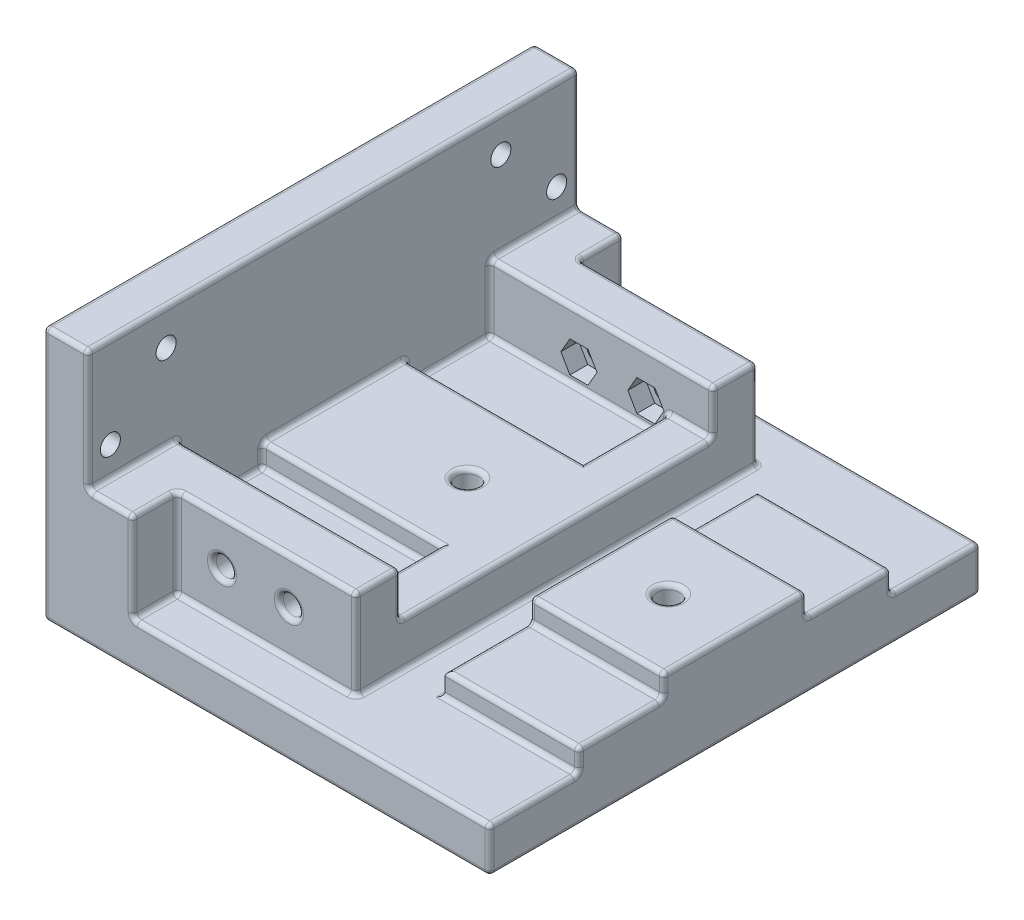
from build123d import *

# Parameters (mm, degrees)
SKETCH1_R                   = 2.25
BOSS_EXTRUDE1_DEPTH         = 10
BOSS_EXTRUDE2_DEPTH         = 50
SKETCH8_W                   = 10
SKETCH8_H                   = 20
BOSS_EXTRUDE3_DEPTH         = 10
SKETCH9_R                   = 2.25
CUT_EXTRUDE4_DEPTH          = 110
CUT_EXTRUDE6_DEPTH          = 4
CUT_EXTRUDE7_DEPTH          = 4
BOSS_EXTRUDE4_DEPTH         = 5
BOSS_EXTRUDE5_DEPTH         = 10
SKETCH17_W                  = 40
SKETCH17_H                  = 10
BOSS_EXTRUDE6_DEPTH         = 10
SKETCH18_W                  = 40
SKETCH18_H                  = 10
BOSS_EXTRUDE7_DEPTH         = 10
BOSS_EXTRUDE8_DEPTH         = 40
SKETCH21_W                  = 30
SKETCH21_H                  = 70
BOSS_EXTRUDE9_DEPTH         = 5
SKETCH22_W                  = 30
SKETCH22_H                  = 32
BOSS_EXTRUDE10_DEPTH        = 5
F_1_4_20_TAPPED_HOLE1_D     = 5.1054
F_1_4_20_TAPPED_HOLE1_DEPTH = 20
F_1_4_20_TAPPED_HOLE1_TIP   = 1.533816902
F_1_4_20_TAPPED_HOLE2_D     = 5.1054
F_1_4_20_TAPPED_HOLE2_DEPTH = 20
F_1_4_20_TAPPED_HOLE2_TIP   = 1.533816902
FILLET5_R                   = 1


with BuildPart() as part:
    # Sketch1 → Boss-Extrude1 (new body)
    with BuildSketch(Plane(origin=(0, 0, 0), x_dir=(0, 0, -1), z_dir=(1, 0, 0))):
        Polygon((-38.693472114, 11.344926417), (-13.193472114, 11.344926417), (45.806527886, 11.344926417), (71.306527886, 11.344926417), (71.306527886, -35.655073583), (-38.693472114, -35.655073583), align=None)
        with Locations((-33.693472114, -9.155073583)):
            Circle(SKETCH1_R, mode=Mode.SUBTRACT)
        with Locations((-21.193472114, 3.344926417)):
            Circle(SKETCH1_R, mode=Mode.SUBTRACT)
        with Locations((66.306527886, -9.155073583)):
            Circle(SKETCH1_R, mode=Mode.SUBTRACT)
        with Locations((53.806527886, 3.344926417)):
            Circle(SKETCH1_R, mode=Mode.SUBTRACT)
    extrude(amount=BOSS_EXTRUDE1_DEPTH)

    # Sketch2 → Boss-Extrude2 (add)
    with BuildSketch(Plane(origin=(10, 0, 0), x_dir=(0, 0, -1), z_dir=(1, 0, 0))):
        Polygon((-28.693472114, -35.655073583), (61.306527886, -35.655073583), (61.306527886, -15.655073583), (51.306527886, -15.655073583), (51.306527886, -30.655073583), (-18.693472114, -30.655073583), (-18.693472114, -15.655073583), (-28.693472114, -15.655073583), align=None)
    extrude(amount=BOSS_EXTRUDE2_DEPTH)

    # Sketch8 → Boss-Extrude3 (add)
    with BuildSketch(Plane(origin=(10, 0, 0), x_dir=(0, 0, -1), z_dir=(1, 0, 0))):
        with Locations((-33.693472114, -25.655073583)):
            Rectangle(SKETCH8_W, SKETCH8_H)
        with Locations((66.306527886, -25.655073583)):
            Rectangle(SKETCH8_W, SKETCH8_H)
    extrude(amount=BOSS_EXTRUDE3_DEPTH)

    # Sketch9 → Cut-Extrude4 (cut)
    with BuildSketch(Plane.XY.offset(28.693472114)):
        with Locations((30, -25.655073583)):
            Circle(SKETCH9_R)
        with Locations((45, -25.655073583)):
            Circle(SKETCH9_R)
    extrude(amount=-CUT_EXTRUDE4_DEPTH, mode=Mode.SUBTRACT)

    # Sketch11 → Cut-Extrude6 (cut)
    with BuildSketch(Plane.XY.offset(-51.306527886)):
        Polygon((49.041451884, -25.655073583), (47.020725942, -22.155073583), (42.979274058, -22.155073583), (40.958548116, -25.655073583), (42.979274058, -29.155073583), (47.020725942, -29.155073583), align=None)
        Polygon((34.041451884, -25.655073583), (32.020725942, -22.155073583), (27.979274058, -22.155073583), (25.958548116, -25.655073583), (27.979274058, -29.155073583), (32.020725942, -29.155073583), align=None)
    extrude(amount=-CUT_EXTRUDE6_DEPTH, mode=Mode.SUBTRACT)

    # Sketch12 → Cut-Extrude7 (cut)
    with BuildSketch(Plane(origin=(0, 0, 18.693472114), x_dir=(-1, 0, 0), z_dir=(0, 0, -1))):
        Polygon((-40.958548116, -25.655073583), (-42.979274058, -22.155073583), (-47.020725942, -22.155073583), (-49.041451884, -25.655073583), (-47.020725942, -29.155073583), (-42.979274058, -29.155073583), align=None)
        Polygon((-25.958548116, -25.655073583), (-27.979274058, -22.155073583), (-32.020725942, -22.155073583), (-34.041451884, -25.655073583), (-32.020725942, -29.155073583), (-27.979274058, -29.155073583), align=None)
    extrude(amount=-CUT_EXTRUDE7_DEPTH, mode=Mode.SUBTRACT)

    # Sketch13 → Boss-Extrude4 (add)
    with BuildSketch(Plane(origin=(0, -30.655073583, 0), x_dir=(1, 0, 0), z_dir=(0, 1, 0))):
        Polygon((60, 51.306527886), (50, 51.306527886), (50, 32.306527886), (10, 32.306527886), (10, 0.306527886), (50, 0.306527886), (50, -18.693472114), (60, -18.693472114), align=None)
    extrude(amount=BOSS_EXTRUDE4_DEPTH)

    # Sketch15 → Boss-Extrude5 (add)
    with BuildSketch(Plane.XZ.offset(35.655073583)):
        Polygon((0, -71.306527886), (20, -71.306527886), (20, -61.306527886), (60, -61.306527886), (60, 28.693472114), (20, 28.693472114), (20, 38.693472114), (0, 38.693472114), align=None)
    extrude(amount=BOSS_EXTRUDE5_DEPTH)

    # Sketch17 → Boss-Extrude6 (add)
    with BuildSketch(Plane.XY.offset(28.693472114)):
        with Locations((40, -40.655073583)):
            Rectangle(SKETCH17_W, SKETCH17_H)
    extrude(amount=BOSS_EXTRUDE6_DEPTH)

    # Sketch18 → Boss-Extrude7 (add)
    with BuildSketch(Plane(origin=(0, 0, -61.306527886), x_dir=(-1, 0, 0), z_dir=(0, 0, -1))):
        with Locations((-40, -40.655073583)):
            Rectangle(SKETCH18_W, SKETCH18_H)
    extrude(amount=BOSS_EXTRUDE7_DEPTH)

    # Sketch19 → Boss-Extrude8 (add)
    with BuildSketch(Plane(origin=(60, 0, 0), x_dir=(0, 0, -1), z_dir=(1, 0, 0))):
        Polygon((-28.693472114, -35.655073583), (61.306527886, -35.655073583), (71.306527886, -35.655073583), (71.306527886, -45.655073583), (-38.693472114, -45.655073583), (-38.693472114, -35.655073583), align=None)
    extrude(amount=BOSS_EXTRUDE8_DEPTH)

    # Sketch21 → Boss-Extrude9 (add)
    with BuildSketch(Plane(origin=(0, -35.655073583, 0), x_dir=(1, 0, 0), z_dir=(0, 1, 0))):
        with Locations((85, 16.306527886)):
            Rectangle(SKETCH21_W, SKETCH21_H)
    extrude(amount=BOSS_EXTRUDE9_DEPTH)

    # Sketch22 → Boss-Extrude10 (add)
    with BuildSketch(Plane(origin=(0, -30.655073583, 0), x_dir=(1, 0, 0), z_dir=(0, 1, 0))):
        with Locations((85, 16.306527886)):
            Rectangle(SKETCH22_W, SKETCH22_H)
    extrude(amount=BOSS_EXTRUDE10_DEPTH)

    # 1/4-20 Tapped Hole1
    with Locations(Plane(origin=(85, -25.655073583, -16.306527886), x_dir=(0, 0, 1), z_dir=(0, 1, 0))):
        with Locations((0, 0)):
            Hole(F_1_4_20_TAPPED_HOLE1_D / 2, depth=F_1_4_20_TAPPED_HOLE1_DEPTH)
            with Locations((0, 0, -(F_1_4_20_TAPPED_HOLE1_DEPTH + F_1_4_20_TAPPED_HOLE1_TIP / 2))):  # 118° drill point
                Cone(0, F_1_4_20_TAPPED_HOLE1_D / 2, F_1_4_20_TAPPED_HOLE1_TIP, mode=Mode.SUBTRACT)

    # 1/4-20 Tapped Hole2
    with Locations(Plane(origin=(40, -25.655073583, -16.306527886), x_dir=(0, 0, 1), z_dir=(0, 1, 0))):
        with Locations((0, 0)):
            Hole(F_1_4_20_TAPPED_HOLE2_D / 2, depth=F_1_4_20_TAPPED_HOLE2_DEPTH)
            with Locations((0, 0, -(F_1_4_20_TAPPED_HOLE2_DEPTH + F_1_4_20_TAPPED_HOLE2_TIP / 2))):  # 118° drill point
                Cone(0, F_1_4_20_TAPPED_HOLE2_D / 2, F_1_4_20_TAPPED_HOLE2_TIP, mode=Mode.SUBTRACT)

    # Fillet5
    fillet5_edges = [part.edges().sort_by_distance(p)[0] for p in [
        (5, 11.344926417, 38.693472114),
        (5, 11.344926417, -71.306527886),
        (10, 11.344926417, -16.306527886),
        (0, -9.155073583, 35.943472114),
        (60, -20.655073583, 18.693472114),
        (30, -30.655073583, 18.693472114),
        (10, -30.655073583, 9.193472114),
        (30, -30.655073583, -51.306527886),
        (50, -30.655073583, -41.806527886),
        (50, -28.155073583, -51.306527886),
        (30, -30.655073583, -32.306527886),
        (10, -28.155073583, -32.306527886),
        (30, -30.655073583, -0.306527886),
        (10, -28.155073583, -0.306527886),
        (50, -30.655073583, 9.193472114),
        (50, -28.155073583, 18.693472114),
        (60, -25.655073583, -16.306527886),
        (55, -25.655073583, -51.306527886),
        (50, -25.655073583, -41.806527886),
        (30, -25.655073583, -32.306527886),
        (10, -25.655073583, -16.306527886),
        (30, -25.655073583, -0.306527886),
        (50, -25.655073583, 9.193472114),
        (55, -25.655073583, 18.693472114),
        (0, 3.344926417, 23.443472114),
        (0, -45.655073583, -16.306527886),
        (50, -45.655073583, -71.306527886),
        (50, -45.655073583, 38.693472114),
        (20, -25.655073583, 28.693472114),
        (20, -35.655073583, 33.693472114),
        (40, -35.655073583, 28.693472114),
        (60, -35.655073583, 38.693472114),
        (20, -25.655073583, -71.306527886),
        (60, -25.655073583, -61.306527886),
        (0, -9.155073583, -64.056527886),
        (40, -35.655073583, -61.306527886),
        (20, -35.655073583, -66.306527886),
        (60, -35.655073583, -71.306527886),
        (60, -35.655073583, -16.306527886),
        (100, -35.655073583, -61.306527886),
        (100, -40.655073583, 38.693472114),
        (100, -45.655073583, -16.306527886),
        (100, -40.655073583, -71.306527886),
        (100, -35.655073583, 28.693472114),
        (70, -35.655073583, -16.306527886),
        (85, -35.655073583, 18.693472114),
        (100, -33.155073583, 18.693472114),
        (85, -35.655073583, -51.306527886),
        (100, -33.155073583, -51.306527886),
        (70, -30.655073583, -41.806527886),
        (85, -30.655073583, 18.693472114),
        (100, -30.655073583, 9.193472114),
        (85, -30.655073583, -51.306527886),
        (0, 3.344926417, -51.556527886),
        (70, -30.655073583, 9.193472114),
        (100, -30.655073583, -41.806527886),
        (85, -30.655073583, -32.306527886),
        (100, -28.155073583, -32.306527886),
        (70, -28.155073583, -32.306527886),
        (85, -30.655073583, -0.306527886),
        (70, -28.155073583, -0.306527886),
        (100, -28.155073583, -0.306527886),
        (85, -25.655073583, -32.306527886),
        (70, -25.655073583, -16.306527886),
        (85, -25.655073583, -0.306527886),
        (100, -25.655073583, -16.306527886),
        (85, -25.655073583, -13.753827886),
        (40, -25.655073583, -13.753827886),
        (40, -15.655073583, 28.693472114),
        (10, -15.655073583, -61.306527886),
        (40, -15.655073583, -61.306527886),
        (10, -23.155073583, -51.306527886),
        (35, -15.655073583, -51.306527886),
        (10, -30.655073583, -41.806527886),
        (10, -23.155073583, 18.693472114),
        (10, -15.655073583, 28.693472114),
        (35, -15.655073583, 18.693472114),
        (60, -25.655073583, 28.693472114),
        (60, -15.655073583, -56.306527886),
        (60, -20.655073583, -51.306527886),
        (60, -15.655073583, 23.693472114),
        (10, -2.155073583, 38.693472114),
        (15, -15.655073583, 38.693472114),
        (20, -15.655073583, 33.693472114),
        (20, -25.655073583, 38.693472114),
        (0, 11.344926417, -16.306527886),
        (10, -2.155073583, -71.306527886),
        (15, -15.655073583, -71.306527886),
        (20, -25.655073583, -61.306527886),
        (20, -15.655073583, -66.306527886),
        (0, -17.155073583, -71.306527886),
        (0, -17.155073583, 38.693472114),
        (27.75, -25.655073583, -61.306527886),
        (27.75, -25.655073583, 28.693472114),
        (42.75, -25.655073583, -61.306527886),
        (42.75, -25.655073583, 28.693472114),
    ]]
    fillet(fillet5_edges, radius=FILLET5_R)


solid = part.part
